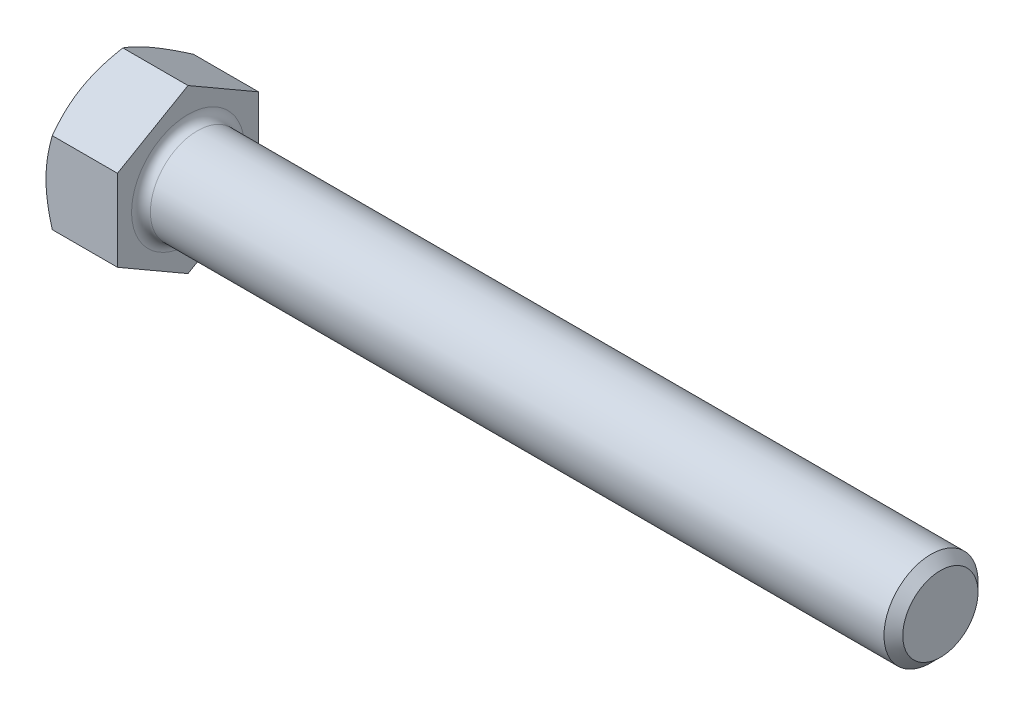
from build123d import *

# Parameters (mm, degrees)
SKETCH1_W      = 50.8
SKETCH1_H      = 3.175
HEAD_DEPTH     = 4.826
CHAMFER2_SIZE  = 0.635
CHAMFER2_SIZE2 = 0.6351
FILLET_2_R     = 0.635


with BuildPart() as part:
    # Sketch1 → Body (revolve)
    with BuildSketch(Plane.XY):
        with Locations((25.4, 1.5875)):
            Rectangle(SKETCH1_W, SKETCH1_H)
    revolve(axis=Axis((50.8, 0, 0), (-1, 0, 0)))

    # Sketch2 → Head (add)
    with BuildSketch(Plane.ZY):
        Polygon((0, 5.499261314), (4.7625, 2.749630657), (4.7625, -2.749630657), (0, -5.499261314), (-4.7625, -2.749630657), (-4.7625, 2.749630657), align=None)
    extrude(amount=HEAD_DEPTH)

    # Sketch3 → Thread (revolve, cut)
    with BuildSketch(Plane.XY):
        Polygon((-4.826, 4.7625), (-4.276073869, 5.715), (-4.826, 5.715), align=None)
    revolve(axis=Axis((-1.1, 0, 0), (1, 0, 0)), mode=Mode.SUBTRACT)

    # Chamfer2
    chamfer2_edges = [part.edges().sort_by_distance(p)[0] for p in [
        (50.8, -3.175, 0),
    ]]
    chamfer2_side = [part.faces().sort_by_distance(p)[0] for p in [
        (25.4, -3.175, 0),
    ]]
    chamfer(chamfer2_edges, length=CHAMFER2_SIZE, length2=CHAMFER2_SIZE2, reference=chamfer2_side[0])

    # Fillet 2
    fillet_2_edges = [part.edges().sort_by_distance(p)[0] for p in [
        (0, -3.175, 0),
    ]]
    fillet(fillet_2_edges, radius=FILLET_2_R)


solid = part.part
